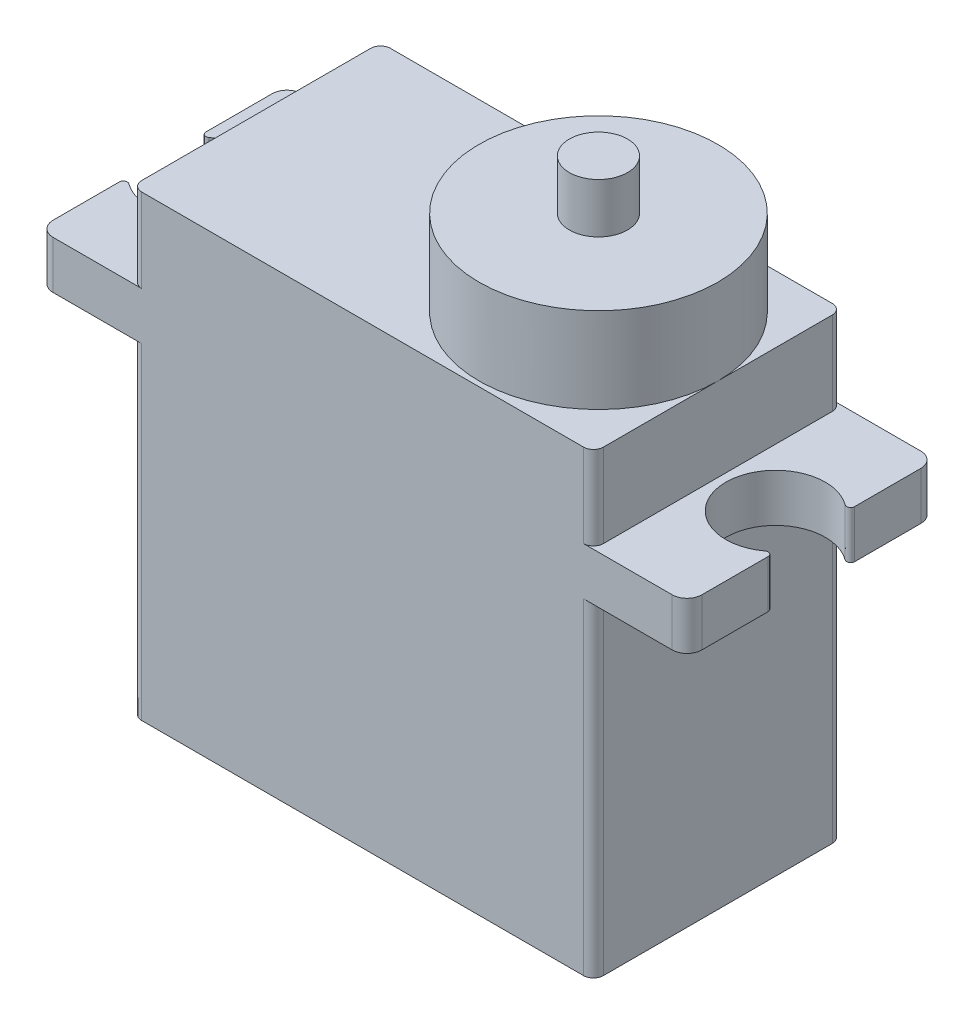
from build123d import *

# Parameters (mm, degrees)
ESQUISSE1_W             = 23.2
ESQUISSE1_H             = 12.5
BOSS_EXTRU_1_DEPTH      = 23
ESQUISSE2_W             = 4.7
ESQUISSE2_H             = 2.4
BOSS_EXTRU_2_DEPTH      = 12.5
CONG_1_R                = 0.75
ESQUISSE3_R             = 2.5
ENL_V_MAT_EXTRU_1_DEPTH = 11.8
CONG_2_R                = 0.2
CONG_3_R                = 0.5
ESQUISSE5_R             = 6
BOSS_EXTRU_3_DEPTH      = 4.3
ESQUISSE6_R             = 1.461217274
BOSS_EXTRU_4_DEPTH      = 2.5


with BuildPart() as part:
    # Esquisse1 → Boss.-Extru.1 (new body)
    with BuildSketch(Plane(origin=(0, 0, 0), x_dir=(1, 0, 0), z_dir=(0, 1, 0))):
        Rectangle(ESQUISSE1_W, ESQUISSE1_H)
    extrude(amount=BOSS_EXTRU_1_DEPTH)

    # Esquisse2 → Boss.-Extru.2 (add)
    with BuildSketch(Plane.XY.offset(6.25)):
        with Locations((13.95, 17.6)):
            Rectangle(ESQUISSE2_W, ESQUISSE2_H)
        with Locations((-13.95, 17.6)):
            Rectangle(ESQUISSE2_W, ESQUISSE2_H)
    extrude(amount=-BOSS_EXTRU_2_DEPTH)

    # Congé1
    cong_1_edges = [part.edges().sort_by_distance(p)[0] for p in [
        (16.3, 17.6, -6.25),
        (16.3, 17.6, 6.25),
        (-16.3, 17.6, -6.25),
        (-16.3, 17.6, 6.25),
    ]]
    fillet(cong_1_edges, radius=CONG_1_R)

    # Esquisse3 → Enlèv. mat.-Extru.1 (cut)
    with BuildSketch(Plane(origin=(0, 23, 0), x_dir=(1, 0, 0), z_dir=(0, 1, 0))):
        with Locations((-14.5, 0)):
            Circle(ESQUISSE3_R)
        with Locations((14.5, 0)):
            Circle(ESQUISSE3_R)
    extrude(amount=-ENL_V_MAT_EXTRU_1_DEPTH, mode=Mode.SUBTRACT)

    # Congé2
    cong_2_edges = [part.edges().sort_by_distance(p)[0] for p in [
        (-16.3, 17.6, -1.734935157),
        (-16.3, 17.6, 1.734935157),
        (16.3, 17.6, -1.734935157),
        (16.3, 17.6, 1.734935157),
    ]]
    fillet(cong_2_edges, radius=CONG_2_R)

    # Congé3
    cong_3_edges = [part.edges().sort_by_distance(p)[0] for p in [
        (11.6, 8.2, -6.25),
        (11.6, 8.2, 6.25),
        (-11.6, 8.2, 6.25),
        (-11.6, 8.2, -6.25),
        (11.6, 20.9, 6.25),
        (-11.6, 20.9, 6.25),
        (-11.6, 20.9, -6.25),
        (11.6, 20.9, -6.25),
    ]]
    fillet(cong_3_edges, radius=CONG_3_R)

    # Esquisse5 → Boss.-Extru.3 (add)
    with BuildSketch(Plane(origin=(0, 23, 0), x_dir=(1, 0, 0), z_dir=(0, 1, 0))):
        with Locations((5.6, 0)):
            Circle(ESQUISSE5_R)
    extrude(amount=BOSS_EXTRU_3_DEPTH)

    # Esquisse6 → Boss.-Extru.4 (add)
    with BuildSketch(Plane(origin=(0, 27.3, 0), x_dir=(1, 0, 0), z_dir=(0, 1, 0))):
        with Locations(Location((5.6, 0, 0), (0, 0, 270))):
            Circle(ESQUISSE6_R)
    extrude(amount=BOSS_EXTRU_4_DEPTH)


solid = part.part
